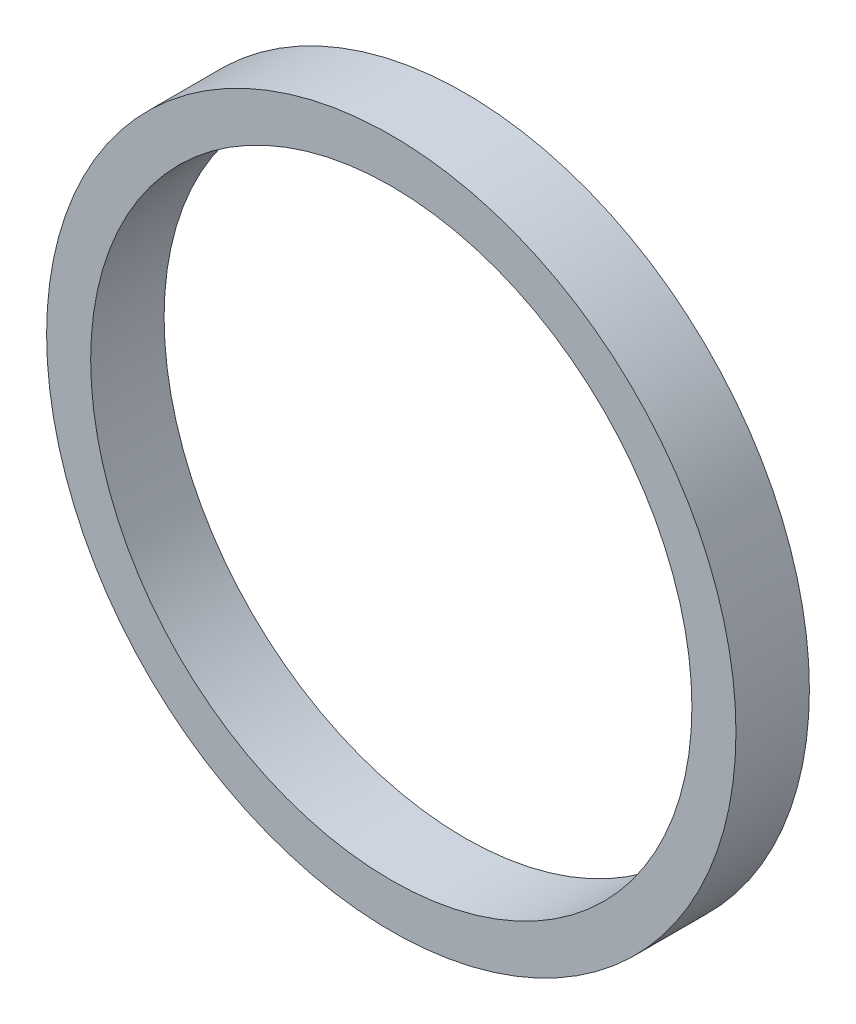
from build123d import *

# Parameters (mm, degrees)
SKETCH1_R           = 37.55
SKETCH1_R_2         = 32.75
BOSS_EXTRUDE1_DEPTH = 8


with BuildPart() as part:
    # Sketch1 → Boss-Extrude1 (new body)
    with BuildSketch(Plane.XY):
        Circle(SKETCH1_R)
        Circle(SKETCH1_R_2, mode=Mode.SUBTRACT)
    extrude(amount=BOSS_EXTRUDE1_DEPTH)


solid = part.part
